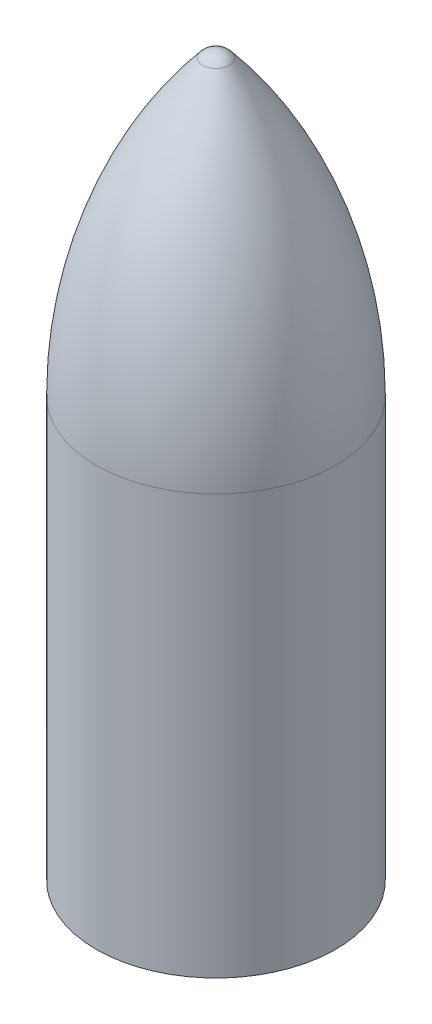
from build123d import *

# Parameters (mm, degrees)
SHELL1_T = -2.54


with BuildPart() as part:
    # Sketch1 → Revolve1 (revolve)
    with BuildSketch(Plane.XY, mode=Mode.PRIVATE) as revolve1_sk:
        with BuildLine():
            Line((-50.8, 0), (-50.8, 177.8))
            ThreePointArc((-50.8, 177.8), (-39.168484212, 243.943124469), (-5.669574396, 302.149894824))
            ThreePointArc((-5.669574396, 302.149894824), (-3.129182452, 304.104769885), (0, 304.8))
            Line((0, 304.8), (0, 0))
            Line((0, 0), (-50.8, 0))
        make_face()
    revolve(revolve1_sk.sketch.rotate(Axis((0, 255.455794576, 0), (0, -1, 0)), 270), axis=Axis((0, 255.455794576, 0), (0, -1, 0)))

    # Shell1
    shell1_openings = [part.faces().sort_by_distance(p)[0] for p in [
        (0, 0, 0),
    ]]
    offset(amount=SHELL1_T, openings=shell1_openings, kind=Kind.INTERSECTION)


solid = part.part
